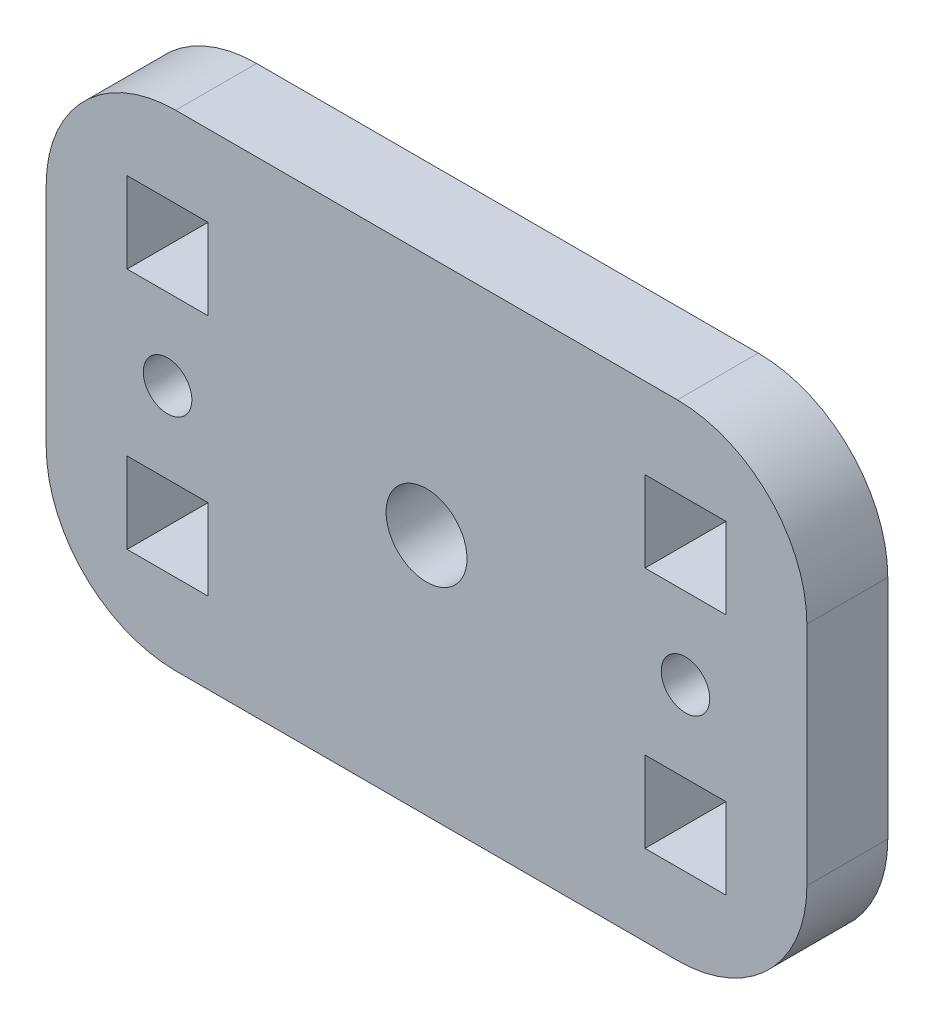
from build123d import *

# Parameters (mm, degrees)
ESQUISSE1_R        = 1.5
ESQUISSE1_R_2      = 2.5
ESQUISSE1_W        = 5
ESQUISSE1_H        = 5
BOSS_EXTRU_1_DEPTH = 5


with BuildPart() as part:
    # Esquisse1 → Boss.-Extru.1 (new body)
    with BuildSketch(Plane.XY):
        with BuildLine():
            Line((8, 0), (39, 0))
            ThreePointArc((39, 0), (44.656854249, 2.343145751), (47, 8))
            Line((47, 8), (47, 22))
            ThreePointArc((47, 22), (44.656854249, 27.656854249), (39, 30))
            Line((39, 30), (8, 30))
            ThreePointArc((8, 30), (2.343145751, 27.656854249), (0, 22))
            Line((0, 22), (0, 8))
            ThreePointArc((0, 8), (2.343145751, 2.343145751), (8, 0))
        make_face()
        with Locations((7.5, 15)):
            Circle(ESQUISSE1_R, mode=Mode.SUBTRACT)
        with Locations((39.5, 15)):
            Circle(ESQUISSE1_R, mode=Mode.SUBTRACT)
        with Locations((23.5, 15)):
            Circle(ESQUISSE1_R_2, mode=Mode.SUBTRACT)
        with Locations((7.5, 22.5)):
            Rectangle(ESQUISSE1_W, ESQUISSE1_H, mode=Mode.SUBTRACT)
        with Locations((39.5, 22.5)):
            Rectangle(ESQUISSE1_W, ESQUISSE1_H, mode=Mode.SUBTRACT)
        with Locations((39.5, 7.5)):
            Rectangle(ESQUISSE1_W, ESQUISSE1_H, mode=Mode.SUBTRACT)
        with Locations((7.5, 7.5)):
            Rectangle(ESQUISSE1_W, ESQUISSE1_H, mode=Mode.SUBTRACT)
    extrude(amount=BOSS_EXTRU_1_DEPTH)


solid = part.part
